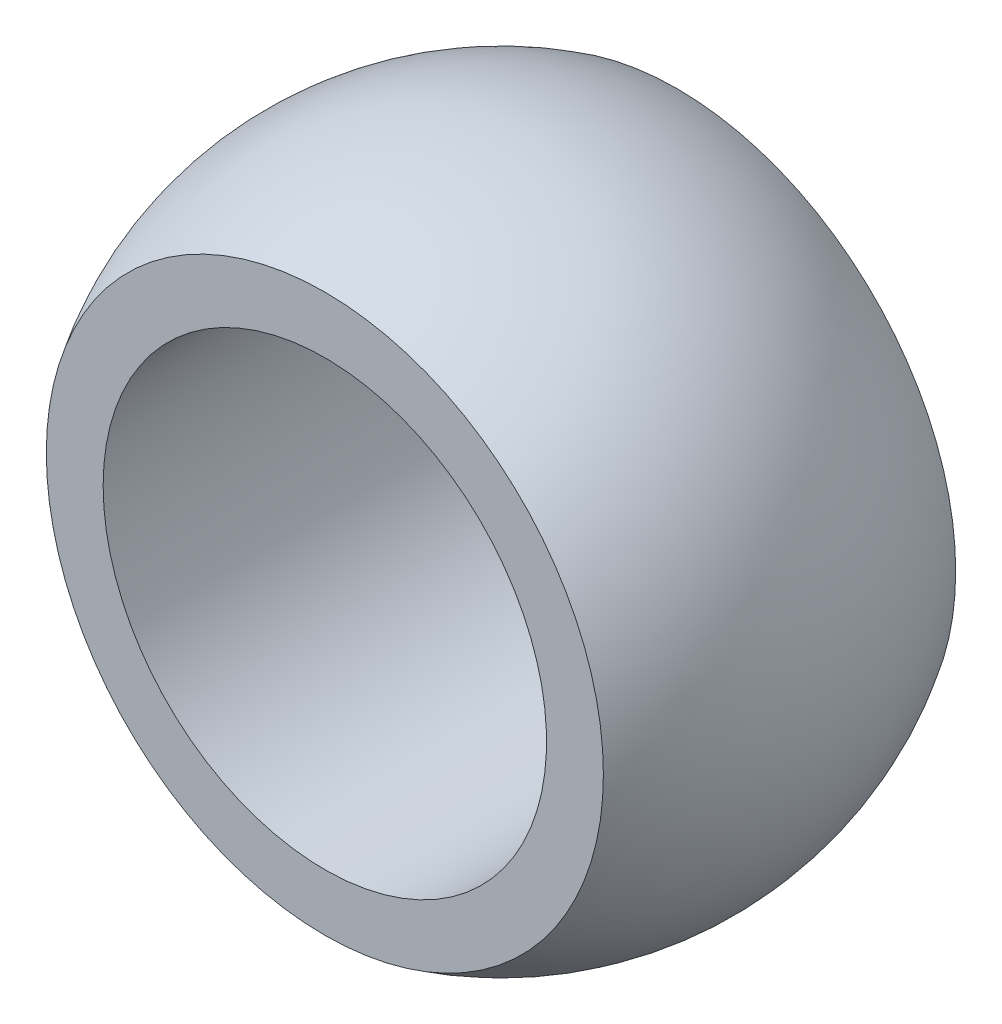
from build123d import *

# Parameters (mm, degrees)
CUT_EXTRUDE_START   = -15.5
SKETCH_2_R          = 29
CUT_EXTRUDE_1_DEPTH = 35.729473419
SKETCH_3_R          = 19.510201958
CUT_EXTRUDE_2_DEPTH = 61.516526668


with BuildPart() as part:
    # Эскиз1 → Повернуть1 (revolve)
    with BuildSketch(Plane.XY):
        with BuildLine():
            Line((0, 29), (0, -29))
            ThreePointArc((0, -29), (29, 0), (0, 29))
        make_face()
    revolve(axis=Axis((0, 0, 0), (0, 1, 0)))

    # Эскиз2 → Вырез-Вытянуть1 (cut, through all)
    with BuildSketch(Plane.XY.offset(CUT_EXTRUDE_START)):
        Circle(SKETCH_2_R)
    cut_extrude_1 = extrude(amount=-CUT_EXTRUDE_1_DEPTH, mode=Mode.SUBTRACT)

    # Зеркальное отражение1: Вырез-Вытянуть1 across plane
    add(cut_extrude_1.mirror(Plane.XY), mode=Mode.SUBTRACT)

    # Эскиз3 → Вырез-Вытянуть2 (cut, through all)
    with BuildSketch(Plane(origin=(0, 0, -15.5), x_dir=(-1, 0, 0), z_dir=(0, 0, -1))):
        Circle(SKETCH_3_R)
    extrude(amount=-CUT_EXTRUDE_2_DEPTH, mode=Mode.SUBTRACT)


solid = part.part
